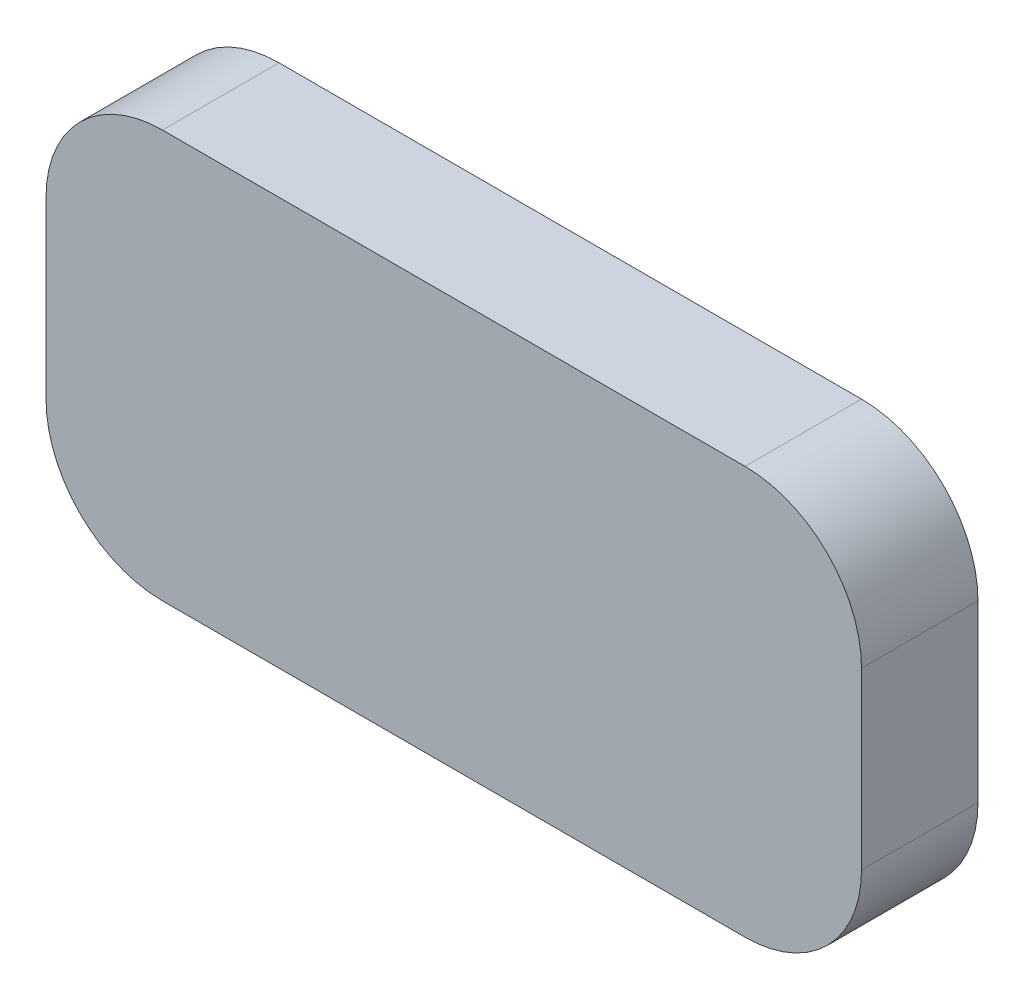
from build123d import *

# Parameters (mm, degrees)
SKETCH_1_W      = 14
SKETCH_1_H      = 7
EXTRUDE_1_DEPTH = 2
FILLET_1_R      = 2


with BuildPart() as part:
    # Эскиз1 → Бобышка-Вытянуть1 (new body)
    with BuildSketch(Plane.XY):
        Rectangle(SKETCH_1_W, SKETCH_1_H)
    extrude(amount=EXTRUDE_1_DEPTH)

    # Скругление1
    fillet_1_edges = [part.edges().sort_by_distance(p)[0] for p in [
        (7, -3.5, 1),
        (-7, -3.5, 1),
        (-7, 3.5, 1),
        (7, 3.5, 1),
    ]]
    fillet(fillet_1_edges, radius=FILLET_1_R)


solid = part.part
